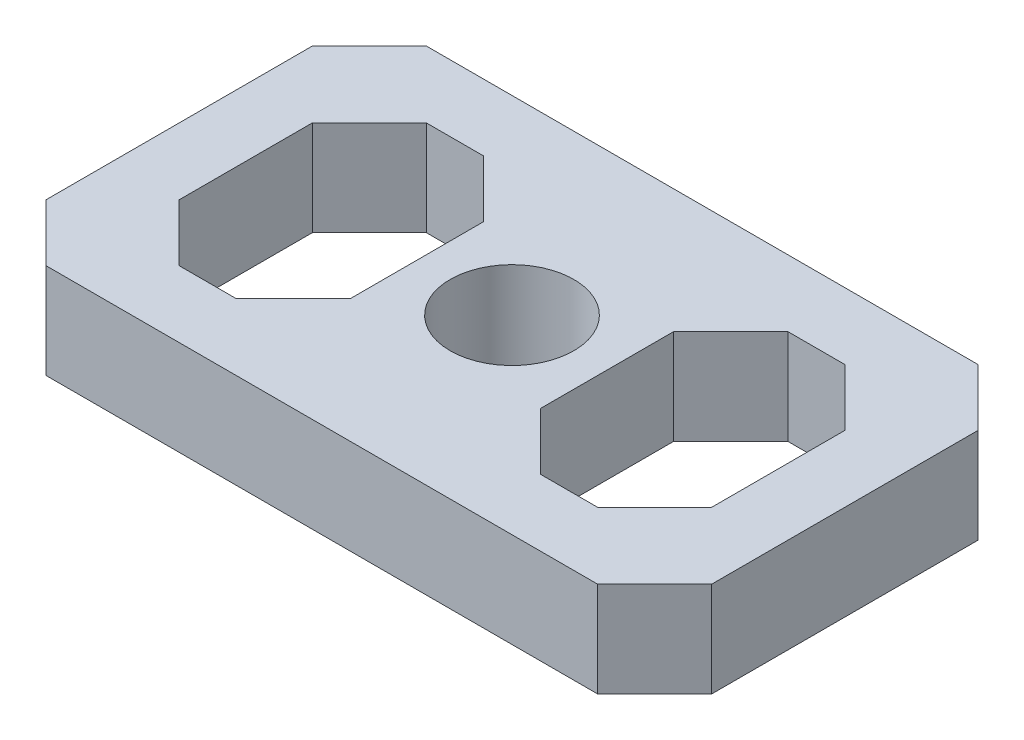
from build123d import *

# Parameters (mm, degrees)
SKETCH1_W           = 70
SKETCH1_H           = 40
SKETCH1_R           = 6.5
SKETCH1_W_2         = 18
SKETCH1_H_2         = 26
BOSS_EXTRUDE1_DEPTH = 10
CHAMFER1_SIZE       = 6


with BuildPart() as part:
    # Sketch1 → Boss-Extrude1 (new body)
    with BuildSketch(Plane(origin=(0, 0, 0), x_dir=(1, 0, 0), z_dir=(0, 1, 0))):
        Rectangle(SKETCH1_W, SKETCH1_H)
        with Locations(Location((0, 0, 0), (0, 0, 270))):
            Circle(SKETCH1_R, mode=Mode.SUBTRACT)
        with Locations((-19, 0)):
            Rectangle(SKETCH1_W_2, SKETCH1_H_2, mode=Mode.SUBTRACT)
        with Locations((19, 0)):
            Rectangle(SKETCH1_W_2, SKETCH1_H_2, mode=Mode.SUBTRACT)
    extrude(amount=BOSS_EXTRUDE1_DEPTH)

    # Chamfer1
    chamfer1_edges = [part.edges().sort_by_distance(p)[0] for p in [
        (-10, 5, 13),
        (-10, 5, -13),
        (-28, 5, -13),
        (-28, 5, 13),
        (28, 5, 13),
        (28, 5, -13),
        (10, 5, -13),
        (10, 5, 13),
        (35, 5, 20),
        (-35, 5, 20),
        (-35, 5, -20),
        (35, 5, -20),
    ]]
    chamfer(chamfer1_edges, length=CHAMFER1_SIZE)


solid = part.part
